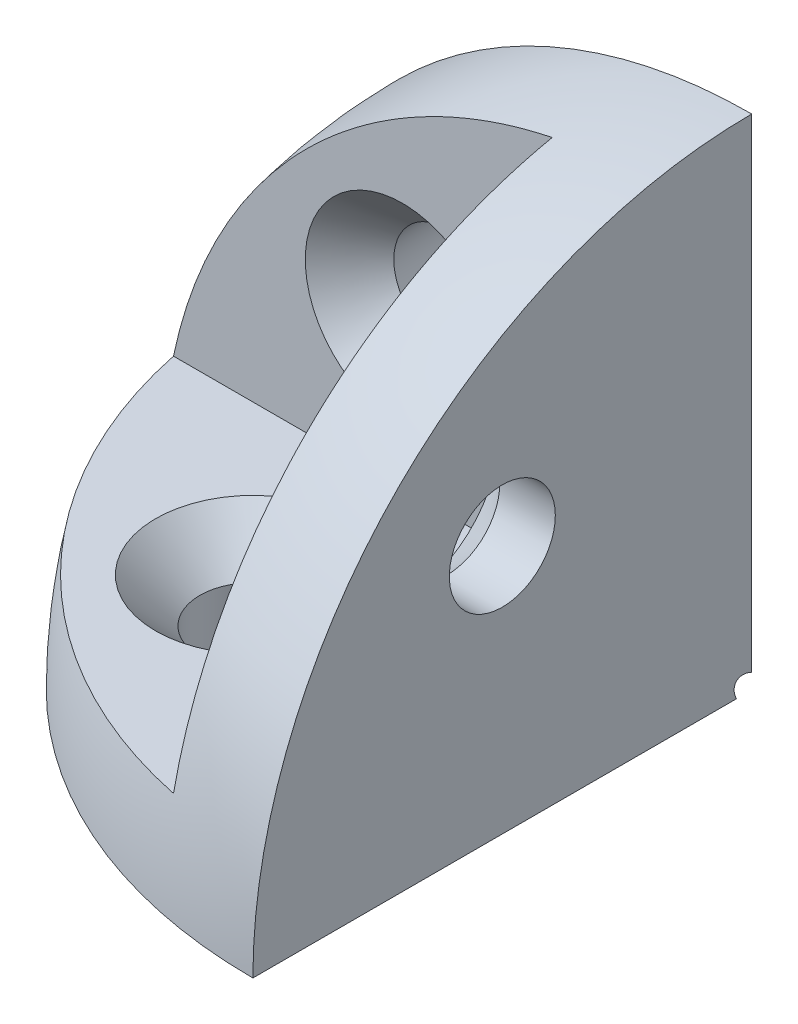
from build123d import *

# Parameters (mm, degrees)
REVOLVE_2_ANGLE     = 90
SHELL_1_T           = -8
SKETCH_3_R          = 4.25
CUT_EXTRUDE_1_DEPTH = 70.282032303
SKETCH_4_R          = 4.25
CUT_EXTRUDE_2_DEPTH = 70.282032303
SKETCH_5_R          = 4.25
CUT_EXTRUDE_3_DEPTH = 70.282032303
CHAMFER_1_SIZE      = 3.55
CHAMFER_2_SIZE      = 3.55
CHAMFER_3_SIZE      = 3.55


with BuildPart() as part:
    # 草图2 → 旋转2 (revolve)
    with BuildSketch(Plane.XY):
        with BuildLine():
            Line((0, 0), (0, 40))
            ThreePointArc((0, 40), (-28.284271247, 28.284271247), (-40, 0))
            Line((-40, 0), (0, 0))
        make_face()
    revolve(axis=Axis((0, 0, 0), (0, 1, 0)), revolution_arc=REVOLVE_2_ANGLE)

    # 抽壳1
    shell_1_openings = [part.faces().sort_by_distance(p)[0] for p in [
        (-20, 28.284271247, 20),
    ]]
    offset(amount=SHELL_1_T, openings=shell_1_openings, kind=Kind.INTERSECTION)

    # 草图3 → 切除-拉伸1 (cut, through all)
    with BuildSketch(Plane(origin=(0, 0, 0), x_dir=(0, 0, -1), z_dir=(1, 0, 0))):
        with Locations((-20, 20)):
            Circle(SKETCH_3_R)
    extrude(amount=-CUT_EXTRUDE_1_DEPTH, mode=Mode.SUBTRACT)

    # 草图4 → 切除-拉伸2 (cut, through all)
    with BuildSketch(Plane(origin=(0, 0, 0), x_dir=(-1, 0, 0), z_dir=(0, 0, -1))):
        with Locations((20, 20)):
            Circle(SKETCH_4_R)
    extrude(amount=-CUT_EXTRUDE_2_DEPTH, mode=Mode.SUBTRACT)

    # 草图5 → 切除-拉伸3 (cut, through all)
    with BuildSketch(Plane.XZ):
        with Locations(Location((-20, 20, 0), (0, 0, 270))):
            Circle(SKETCH_5_R)
    extrude(amount=-CUT_EXTRUDE_3_DEPTH, mode=Mode.SUBTRACT)

    # 倒角1
    chamfer_1_edges = [part.edges().sort_by_distance(p)[0] for p in [
        (-8, 20, 24.25),
    ]]
    chamfer(chamfer_1_edges, length=CHAMFER_1_SIZE)

    # 倒角2
    chamfer_2_edges = [part.edges().sort_by_distance(p)[0] for p in [
        (-15.75, 20, 8),
    ]]
    chamfer(chamfer_2_edges, length=CHAMFER_2_SIZE)

    # 倒角3
    chamfer_3_edges = [part.edges().sort_by_distance(p)[0] for p in [
        (-20, 8, 24.25),
    ]]
    chamfer(chamfer_3_edges, length=CHAMFER_3_SIZE)

    # 草图9 → 切除-旋转2 (revolve, cut)
    with BuildSketch(Plane(origin=(0, 0, 0), x_dir=(-0.7071067811865464, 0, 0.7071067811865488), z_dir=(-0.7071067811865488, 0, -0.7071067811865464)), mode=Mode.PRIVATE) as cut_revolve_2_sk:
        Polygon((-5.259009462, -3.718681253), (16.625182172, 11.755779052), (17.202532441, 10.939282471), (-4.592338975, -4.472018902), align=None)
    revolve(cut_revolve_2_sk.sketch.rotate(Axis((3.718681253, -3.718681253, -3.718681253), (-0.5773502691896244, 0.5773502691896266, 0.5773502691896265)), 180), axis=Axis((3.718681253, -3.718681253, -3.718681253), (-0.5773502691896244, 0.5773502691896266, 0.5773502691896265)), mode=Mode.SUBTRACT)


solid = part.part
